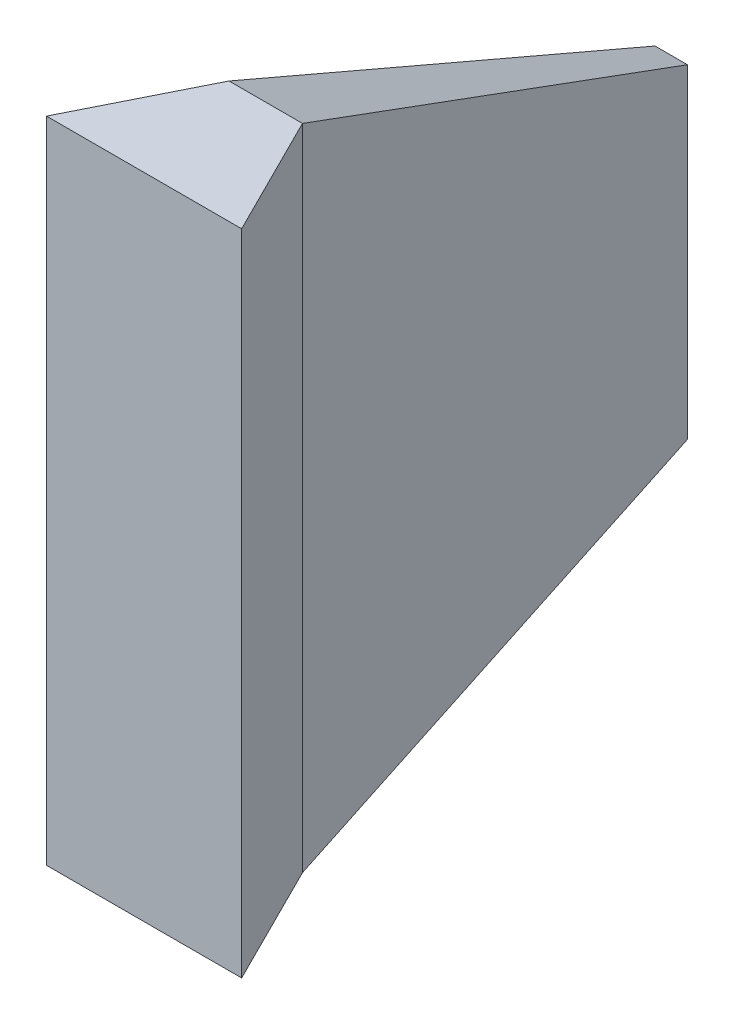
from build123d import *

# Parameters (mm, degrees)
BOSS_EXTRUDE1_DEPTH = 80
SKETCH2_W           = 9.06
SKETCH2_H           = 80
BOSS_EXTRUDE2_DEPTH = 50
CUT_EXTRUDE1_DEPTH  = 105.399039741
CUT_EXTRUDE2_DEPTH  = 106.848049103


with BuildPart() as part:
    # Sketch1 → Boss-Extrude1 (new body)
    with BuildSketch(Plane(origin=(0, 0, 0), x_dir=(1, 0, 0), z_dir=(0, 1, 0))):
        Polygon((-24.06, 0), (-16.56, 14.999429989), (-7.5, 14.999429989), (0, 0), align=None)
    extrude(amount=BOSS_EXTRUDE1_DEPTH)

    # Sketch2 → Boss-Extrude2 (add)
    with BuildSketch(Plane(origin=(0, 0, -14.999429989), x_dir=(-1, 0, 0), z_dir=(0, 0, -1))):
        with Locations((12.03, 40)):
            Rectangle(SKETCH2_W, SKETCH2_H)
    extrude(amount=BOSS_EXTRUDE2_DEPTH)

    # Sketch3 → Cut-Extrude1 (cut, through all)
    with BuildSketch(Plane.ZY.offset(16.56)):
        Polygon((-14.999429989, 80), (-64.999429989, 60), (-64.999429989, 80), align=None)
        Polygon((-64.999429989, 0), (-64.999429989, 20), (-14.999429989, 0), align=None)
    extrude(amount=-CUT_EXTRUDE1_DEPTH, mode=Mode.SUBTRACT)

    # Sketch7 → Cut-Extrude2 (cut, through all)
    with BuildSketch(Plane(origin=(0, 80, 0), x_dir=(1, 0, 0), z_dir=(0, 1, 0))):
        Polygon((-16.56, 14.999429989), (-14.03, 64.999429989), (-16.56, 64.999429989), align=None)
        Polygon((-7.5, 14.999429989), (-7.5, 64.999429989), (-10.03, 64.999429989), align=None)
    extrude(amount=-CUT_EXTRUDE2_DEPTH, mode=Mode.SUBTRACT)


solid = part.part
